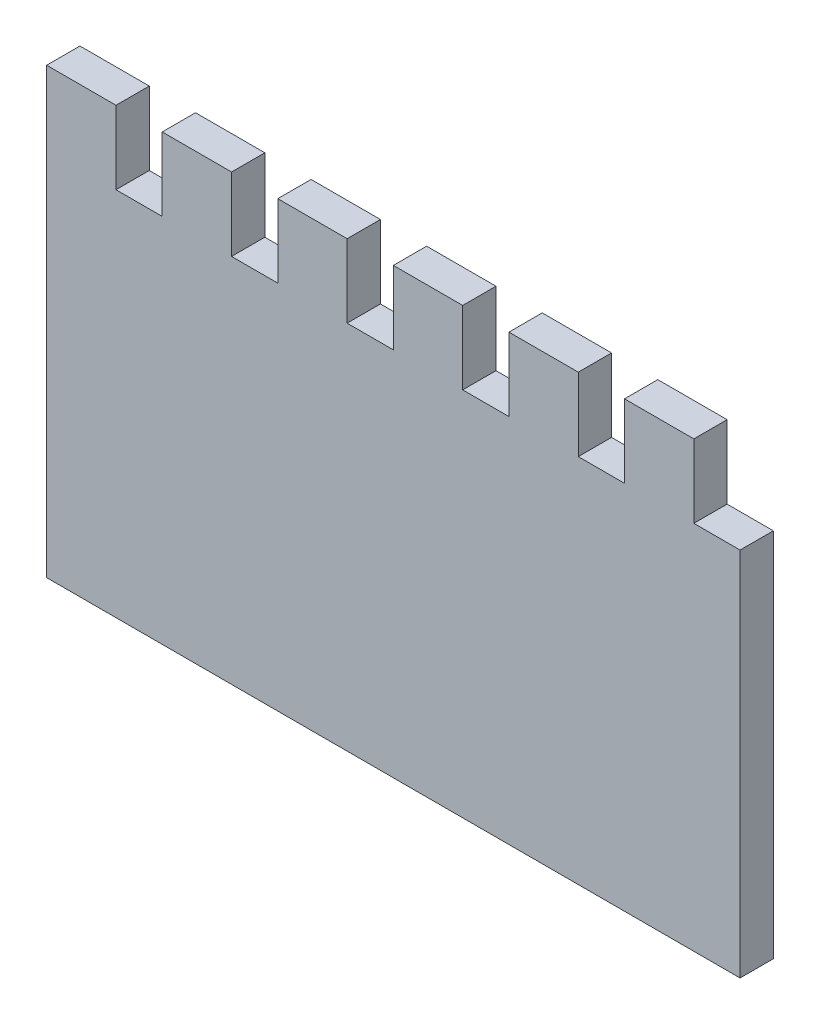
from build123d import *

# Parameters (mm, degrees)
SKETCH1_W           = 38100
SKETCH1_H           = 24384
BOSS_EXTRUDE1_DEPTH = 1828.8
SKETCH2_W           = 2540
SKETCH2_H           = 4019.249447419
CUT_EXTRUDE2_DEPTH  = 1828.8


with BuildPart() as part:
    # Sketch1 → Boss-Extrude1 (new body)
    with BuildSketch(Plane.XY):
        with Locations((19050, 12192)):
            Rectangle(SKETCH1_W, SKETCH1_H)
    extrude(amount=BOSS_EXTRUDE1_DEPTH)

    # Sketch2 → Cut-Extrude2 (cut)
    with BuildSketch(Plane.XY.offset(1828.8)):
        with Locations((5080, 22374.37527629)):
            Rectangle(SKETCH2_W, SKETCH2_H)
        Polygon((11430, 24384), (10160, 24384), (10160, 20364.750552581), (12700, 20364.750552581), (12700, 24384), align=None)
        with Locations((17780, 22374.37527629)):
            Rectangle(SKETCH2_W, SKETCH2_H)
        with Locations((24130, 22374.37527629)):
            Rectangle(SKETCH2_W, SKETCH2_H)
        with Locations((30480, 22374.37527629)):
            Rectangle(SKETCH2_W, SKETCH2_H)
        with Locations((36830, 22374.37527629)):
            Rectangle(SKETCH2_W, SKETCH2_H)
    extrude(amount=-CUT_EXTRUDE2_DEPTH, mode=Mode.SUBTRACT)


solid = part.part
